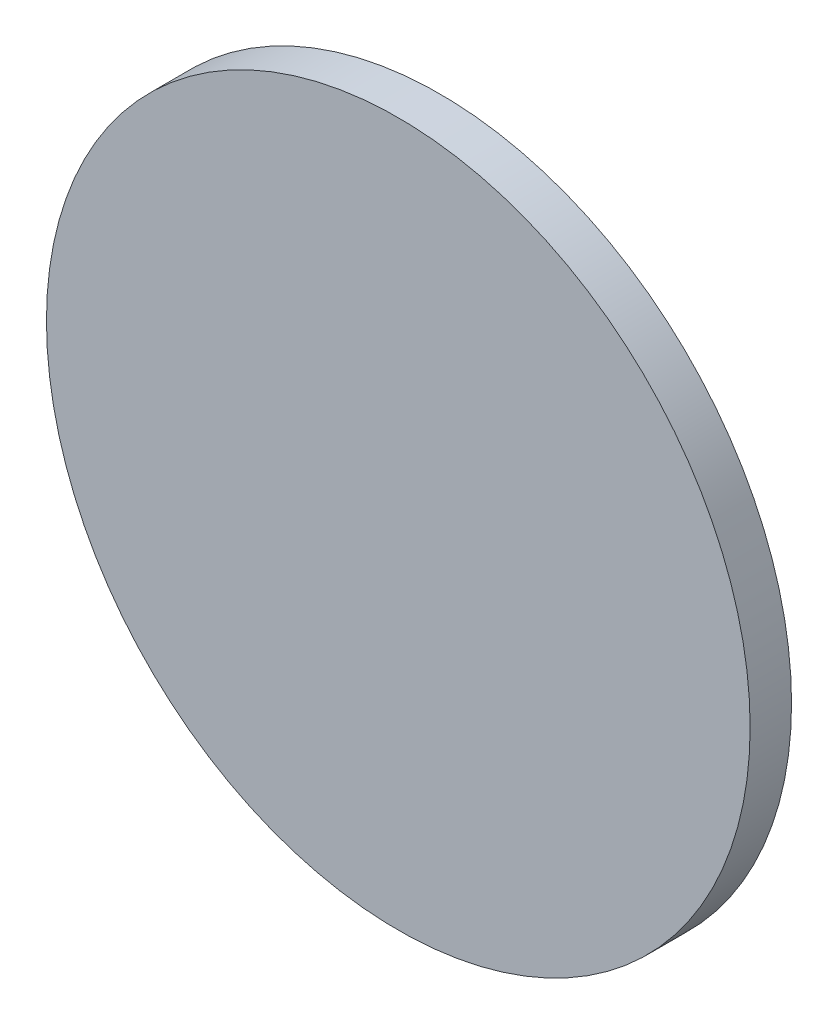
from build123d import *

# Parameters (mm, degrees)
SKETCH_2_R      = 34
EXTRUDE_1_DEPTH = 4


with BuildPart() as part:
    # 草图2 → 凸台-拉伸1 (new body)
    with BuildSketch(Plane.XY):
        Circle(SKETCH_2_R)
    extrude(amount=EXTRUDE_1_DEPTH)


solid = part.part
